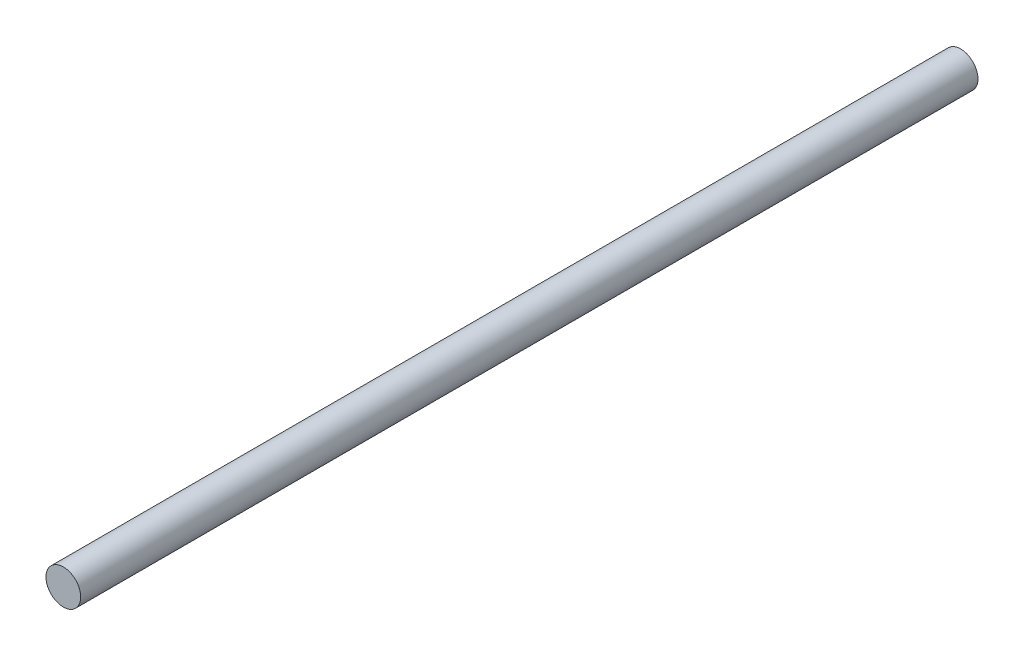
from build123d import *

# Parameters (mm, degrees)
SKETCH1_R           = 6
BOSS_EXTRUDE1_DEPTH = 310


with BuildPart() as part:
    # Sketch1 → Boss-Extrude1 (new body)
    with BuildSketch(Plane.XY):
        Circle(SKETCH1_R)
    extrude(amount=BOSS_EXTRUDE1_DEPTH)


solid = part.part
